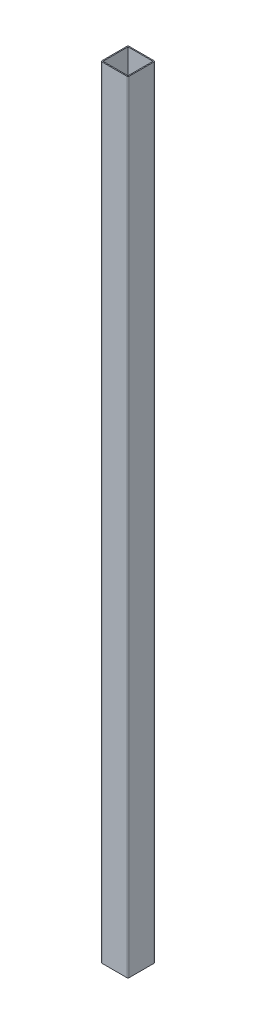
from build123d import *

# Parameters (mm, degrees)
F_8639_82_150_X_150_X_7_0_1_DEPTH = 4614


with BuildPart() as part:
    # Sketch1 → Квадратная труба гост 8639-82 150 X 150 X 7.0(1) (new body)
    with BuildSketch(Plane.XZ):
        with BuildLine():
            Line((-73.999, -80), (73.999, -80))
            ThreePointArc((73.999, -80), (78.242347794, -78.242347794), (80, -73.999))
            Line((80, -73.999), (80, 73.999))
            ThreePointArc((80, 73.999), (78.242347794, 78.242347794), (73.999, 80))
            Line((73.999, 80), (-73.999, 80))
            ThreePointArc((-73.999, 80), (-78.242347794, 78.242347794), (-80, 73.999))
            Line((-80, 73.999), (-80, -73.999))
            ThreePointArc((-80, -73.999), (-78.242347794, -78.242347794), (-73.999, -80))
        make_face()
        with BuildLine():
            Line((-73.999, -74), (73.999, -74))
            ThreePointArc((73.999, -74), (73.999707107, -73.999707107), (74, -73.999))
            Line((74, -73.999), (74, 73.999))
            ThreePointArc((74, 73.999), (73.999707107, 73.999707107), (73.999, 74))
            Line((73.999, 74), (-73.999, 74))
            ThreePointArc((-73.999, 74), (-73.999707107, 73.999707107), (-74, 73.999))
            Line((-74, 73.999), (-74, -73.999))
            ThreePointArc((-74, -73.999), (-73.999707107, -73.999707107), (-73.999, -74))
        make_face(mode=Mode.SUBTRACT)
    extrude(amount=F_8639_82_150_X_150_X_7_0_1_DEPTH)


solid = part.part
